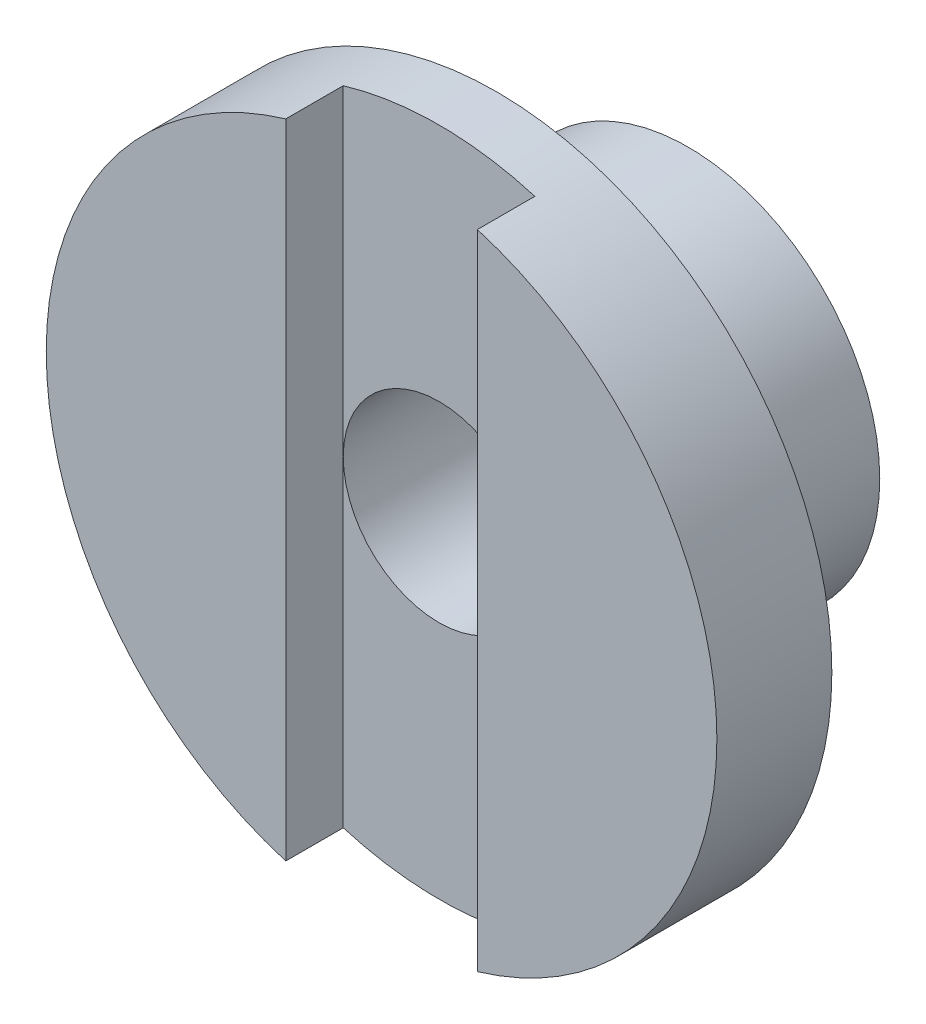
from build123d import *
from build123d.topology import SkipClean

# Parameters (mm, degrees)
SKETCH1_R           = 17.5
BOSS_EXTRUDE1_DEPTH = 6
CUT_EXTRUDE1_START  = -3
CUT_EXTRUDE1_DEPTH  = 3
SKETCH3_R           = 5
CUT_EXTRUDE2_DEPTH  = 11
SKETCH4_R           = 10
SKETCH4_R_2         = 5
BOSS_EXTRUDE2_DEPTH = 10


with BuildPart() as part:
    # Sketch1 → Boss-Extrude1 (new body)
    with BuildSketch(Plane.XY):
        Circle(SKETCH1_R)
    extrude(amount=BOSS_EXTRUDE1_DEPTH)

    # Sketch2 → Cut-Extrude1 (cut)
    with BuildSketch(Plane.XY.offset(6).offset(CUT_EXTRUDE1_START)):
        with BuildLine():
            Line((-5, 16.770509831), (-5, -16.770509831))
            ThreePointArc((-5, -16.770509831), (0, -17.5), (5, -16.770509831))
            Line((5, -16.770509831), (5, 16.770509831))
            ThreePointArc((5, 16.770509831), (0, 17.5), (-5, 16.770509831))
        make_face()
    extrude(amount=CUT_EXTRUDE1_DEPTH, mode=Mode.SUBTRACT)

    # Sketch3 → Cut-Extrude2 (cut)
    with BuildSketch(Plane.XY.offset(6)):
        Circle(SKETCH3_R)
    extrude(amount=-CUT_EXTRUDE2_DEPTH, mode=Mode.SUBTRACT)

    # Sketch4 → Boss-Extrude2 (add)
    with SkipClean():  # the faces are left unmerged after this step: merging them gives an invalid solid
        with BuildSketch(Plane(origin=(0, 0, 0), x_dir=(-1, 0, 0), z_dir=(0, 0, -1))):
            with Locations(Location((0, 0, 0), (0, 0, 180))):
                Circle(SKETCH4_R)
            Circle(SKETCH4_R_2, mode=Mode.SUBTRACT)
        extrude(amount=BOSS_EXTRUDE2_DEPTH)


solid = part.part
